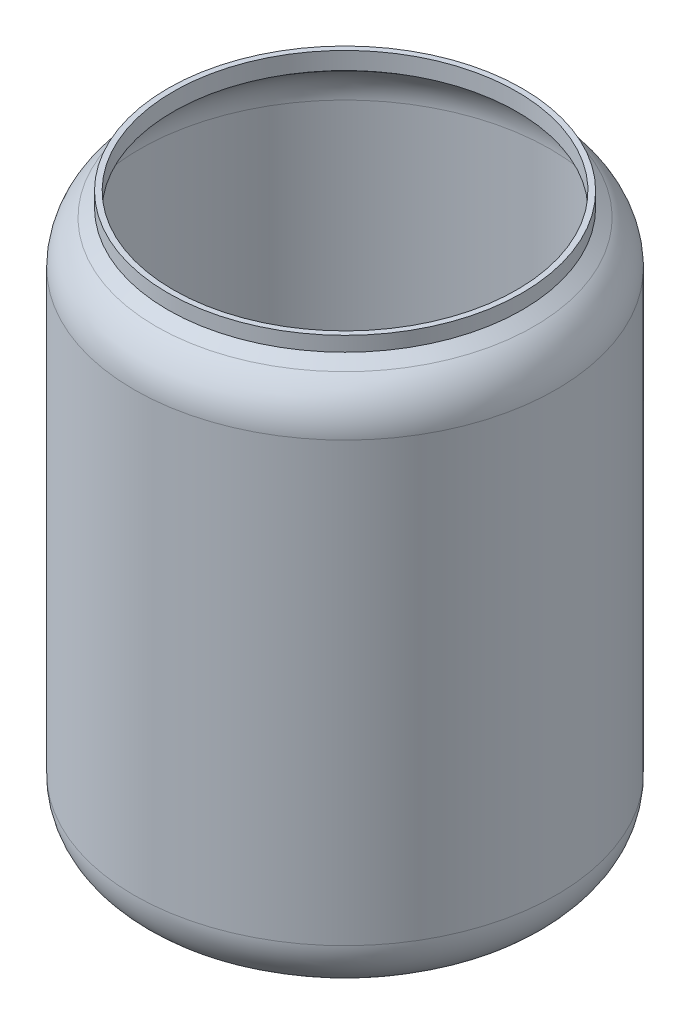
from build123d import *


with BuildPart() as part:
    # Sketch1 → Revolve1 (revolve)
    with BuildSketch(Plane.XY, mode=Mode.PRIVATE) as revolve1_sk:
        with BuildLine():
            Line((39, 90.931199499), (39, 10))
            ThreePointArc((39, 10), (36.071067812, 2.928932188), (29, 0))
            Line((29, 0), (0, 0))
            Line((0, 0), (0, 1))
            Line((0, 1), (29, 1))
            ThreePointArc((29, 1), (35.363961031, 3.636038969), (38, 10))
            Line((38, 10), (38, 90.931199499))
            ThreePointArc((38, 90.931199499), (37.027631255, 95.000245632), (34.320636349, 98.190044369))
            Line((34.320636349, 98.190044369), (31.752687074, 100.072316893))
            Line((31.752687074, 100.072316893), (31.752687074, 103.288460274))
            Line((31.752687074, 103.288460274), (32.752687074, 103.288460274))
            Line((32.752687074, 103.288460274), (32.752687074, 100.579196943))
            Line((32.752687074, 100.579196943), (34.911818166, 98.996582688))
            ThreePointArc((34.911818166, 98.996582688), (37.919590284, 95.452361869), (39, 90.931199499))
        make_face()
    revolve(revolve1_sk.sketch.rotate(Axis((0, 85.763888889, 0), (0, -1, 0)), 90), axis=Axis((0, 85.763888889, 0), (0, -1, 0)))


solid = part.part
